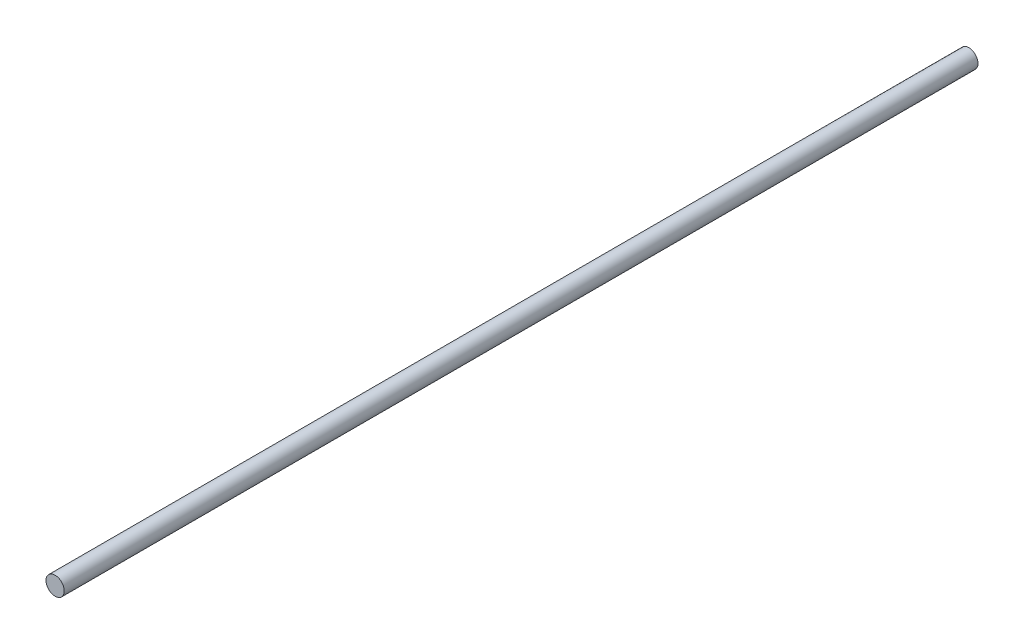
from build123d import *

# Parameters (mm, degrees)
SKETCH1_R           = 1
BOSS_EXTRUDE1_DEPTH = 50


with BuildPart() as part:
    # Sketch1 → Boss-Extrude1 (new, symmetric)
    with BuildSketch(Plane.XY):
        Circle(SKETCH1_R)
    extrude(amount=BOSS_EXTRUDE1_DEPTH, both=True)


solid = part.part
